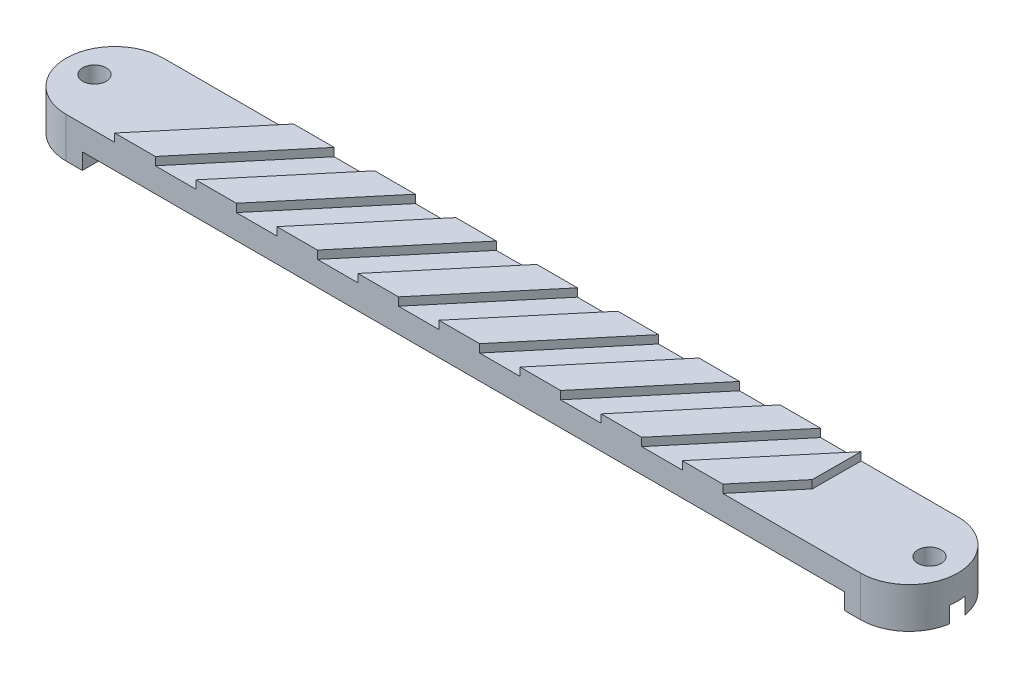
from build123d import *

# Parameters (mm, degrees)
SKETCH1_R           = 1.45
BOSS_EXTRUDE1_DEPTH = 3
BOSS_EXTRUDE2_START = 2
BOSS_EXTRUDE2_DEPTH = 2
BOSS_EXTRUDE3_DEPTH = 1


with BuildPart() as part:
    # Sketch1 → Boss-Extrude1 (new body)
    with BuildSketch(Plane(origin=(0, 0, 0), x_dir=(1, 0, 0), z_dir=(0, 1, 0))):
        with BuildLine():
            Line((-49, 6), (49, 6))
            ThreePointArc((49, 6), (55, 0), (49, -6))
            Line((49, -6), (-49, -6))
            ThreePointArc((-49, -6), (-55, 0), (-49, 6))
        make_face()
        with Locations(Location((-51.5, 0, 0), (0, 0, 270))):
            Circle(SKETCH1_R, mode=Mode.SUBTRACT)
        with Locations(Location((51.5, 0, 0), (0, 0, 270))):
            Circle(SKETCH1_R, mode=Mode.SUBTRACT)
    extrude(amount=BOSS_EXTRUDE1_DEPTH)

    # Sketch2 → Boss-Extrude2 (add)
    with BuildSketch(Plane.XZ.offset(BOSS_EXTRUDE2_START)):
        with BuildLine():
            Line((54.920031913, -0.976330963), (53.491858429, -3.45))
            Line((53.491858429, -3.45), (49.508141571, -3.45))
            Line((49.508141571, -3.45), (47.516283143, 0))
            Line((47.516283143, 0), (49.508141571, 3.45))
            Line((49.508141571, 3.45), (53.491858429, 3.45))
            Line((53.491858429, 3.45), (54.920031913, 0.976330963))
            ThreePointArc((54.920031913, 0.976330963), (52.882139502, 4.574821624), (49, 6))
            Line((49, 6), (47, 6))
            Line((47, 6), (47, -6))
            Line((47, -6), (49, -6))
            ThreePointArc((49, -6), (52.882139502, -4.574821624), (54.920031913, -0.976330963))
        make_face()
        with BuildLine():
            Line((-49, -6), (-47, -6))
            Line((-47, -6), (-47, 6))
            Line((-47, 6), (-49, 6))
            ThreePointArc((-49, 6), (-52.882139502, 4.574821624), (-54.920031913, 0.976330963))
            Line((-54.920031913, 0.976330963), (-53.491858429, 3.45))
            Line((-53.491858429, 3.45), (-49.508141571, 3.45))
            Line((-49.508141571, 3.45), (-47.516283143, 0))
            Line((-47.516283143, 0), (-49.508141571, -3.45))
            Line((-49.508141571, -3.45), (-53.491858429, -3.45))
            Line((-53.491858429, -3.45), (-54.920031913, -0.976330963))
            ThreePointArc((-54.920031913, -0.976330963), (-52.882139502, -4.574821624), (-49, -6))
        make_face()
    extrude(amount=-BOSS_EXTRUDE2_DEPTH)

    # Sketch3 → Boss-Extrude3 (add)
    with BuildSketch(Plane(origin=(0, 3, 0), x_dir=(1, 0, 0), z_dir=(0, 1, 0))):
        Polygon((-32.930804426, 6), (-43, -6), (-38, -6), (-27.930804426, 6), align=None)
        Polygon((-17.930804426, 6), (-22.930804426, 6), (-33, -6), (-28, -6), align=None)
        Polygon((-7.930804426, 6), (-12.930804426, 6), (-23, -6), (-18, -6), align=None)
        Polygon((2.069195574, 6), (-2.930804426, 6), (-13, -6), (-8, -6), align=None)
        Polygon((12.069195574, 6), (7.069195574, 6), (-3, -6), (2, -6), align=None)
        Polygon((22.069195574, 6), (17.069195574, 6), (7, -6), (12, -6), align=None)
        Polygon((32.069195574, 6), (27.069195574, 6), (17, -6), (22, -6), align=None)
        Polygon((37.069195574, 6), (27, -6), (32, -6), (37.034597787, 0), align=None)
    extrude(amount=BOSS_EXTRUDE3_DEPTH)


solid = part.part
